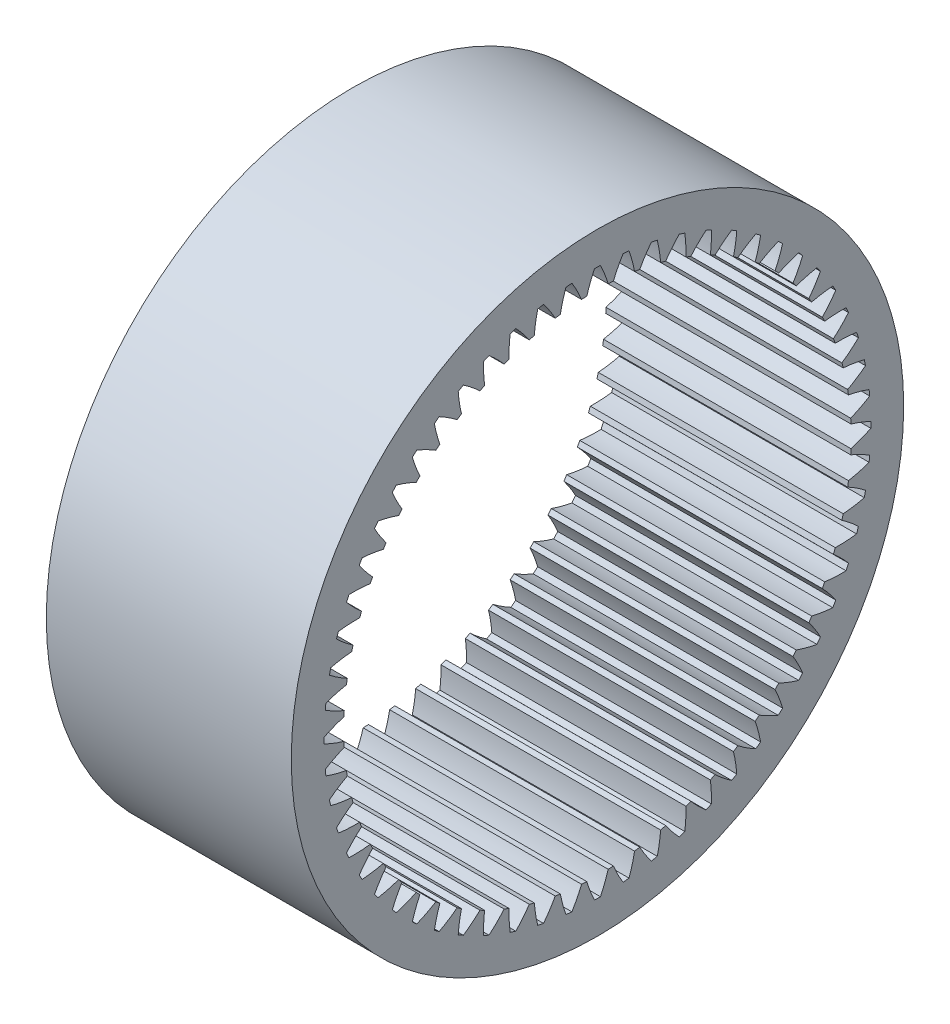
from build123d import *

# Parameters (mm, degrees)
BASPROSKE_W     = 28
BASPROSKE_H     = 6
TOOTHCUT_DEPTH  = 57.868268832
TEETHCUTS_COUNT = 60
TEETHCUTS_ANGLE = 354


with BuildPart() as part:
    # BasProSke → Base-Revolve (revolve)
    with BuildSketch(Plane(origin=(0, 0, 0), x_dir=(1, 0, 0), z_dir=(0, 1, 0)), mode=Mode.PRIVATE) as base_revolve_sk:
        with Locations((14, 32)):
            Rectangle(BASPROSKE_W, BASPROSKE_H)
    revolve(base_revolve_sk.sketch.rotate(Axis((-10, 0, 0), (1, 0, 0)), 180), axis=Axis((-10, 0, 0), (1, 0, 0)))

    # TooCutSke → ToothCut (cut, through all)
    with BuildSketch(Plane(origin=(0, 0, 0), x_dir=(0, 0, -1), z_dir=(1, 0, 0))):
        with BuildLine():
            ThreePointArc((1.227357706, 28.948593027), (0.830805794, 30.117149174), (0.339543276, 31.24915537))
            ThreePointArc((0.339543276, 31.24915537), (0, 31.251), (-0.339543276, 31.24915537))
            ThreePointArc((-0.339543276, 31.24915537), (-0.830805794, 30.117149174), (-1.227357706, 28.948593027))
            ThreePointArc((-1.227357706, 28.948593027), (0, 28.9746), (1.227357706, 28.948593027))
        make_face()
    toothcut = extrude(amount=TOOTHCUT_DEPTH, mode=Mode.SUBTRACT)

    # TeethCuts: ToothCut ×60 about axis
    teethcuts_axis = Axis((-10, 0, 0), (1, 0, 0))
    for i in range(1, TEETHCUTS_COUNT):
        add(toothcut.rotate(teethcuts_axis, i * TEETHCUTS_ANGLE / (TEETHCUTS_COUNT - 1)), mode=Mode.SUBTRACT)


solid = part.part
